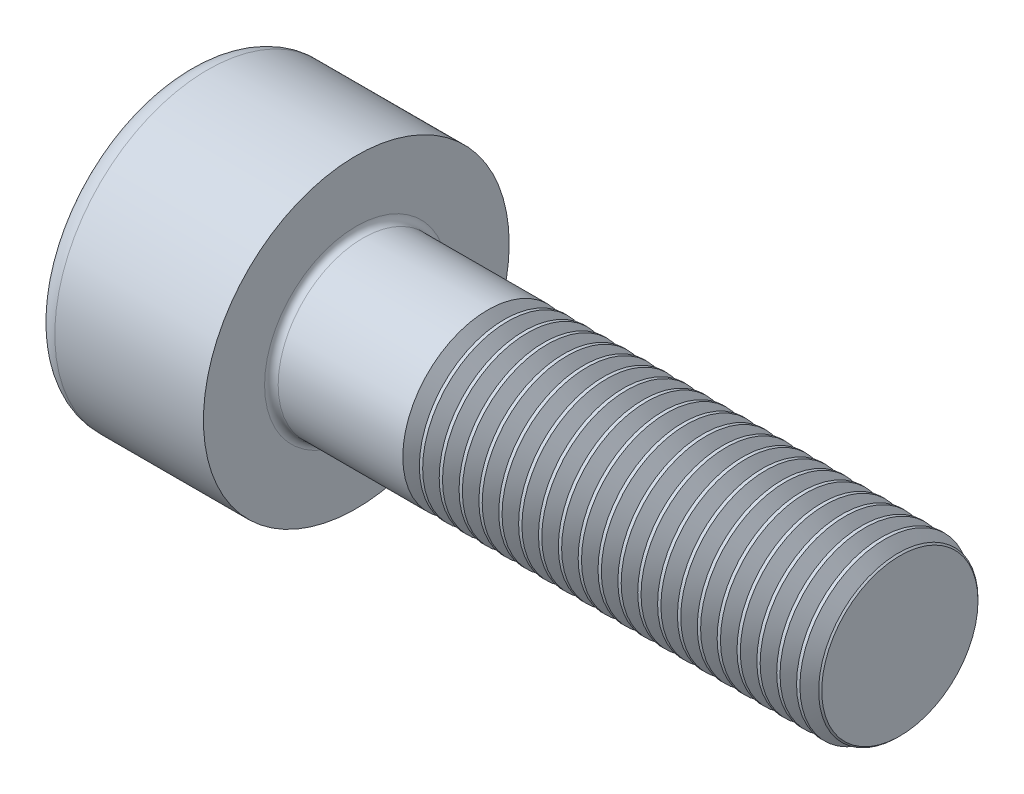
from build123d import *

# Parameters (mm, degrees)
SKETCH1_R           = 2.25
BASEHEAD_DEPTH      = 2.5
SKETCH2_R           = 1.25
BASEBODY_DEPTH      = 8
HEXAGONSOCKET_DEPTH = 1.1
HEADFILLET_R        = 0.1
TOPFILLET_R         = 0.3125
CHAMFER1_SIZE       = 0.1
LPATTERN10_COUNT    = 21
LPATTERN10_PITCH    = 0.2922


with BuildPart() as part:
    # Sketch1 → BaseHead (new body)
    with BuildSketch(Plane(origin=(0, 0, 0), x_dir=(0, 0, -1), z_dir=(1, 0, 0))):
        Circle(SKETCH1_R)
    extrude(amount=BASEHEAD_DEPTH)

    # Sketch2 → BaseBody (add)
    with BuildSketch(Plane(origin=(2.5, 0, 0), x_dir=(0, 0, -1), z_dir=(1, 0, 0))):
        Circle(SKETCH2_R)
    extrude(amount=BASEBODY_DEPTH)

    # Sketch3 → HexagonSocket (cut)
    with BuildSketch(Plane(origin=(0, 0, 0), x_dir=(0, 0, -1), z_dir=(1, 0, 0))):
        Polygon((1.154700538, 0), (0.577350269, 1), (-0.577350269, 1), (-1.154700538, 0), (-0.577350269, -1), (0.577350269, -1), align=None)
    extrude(amount=HEXAGONSOCKET_DEPTH, mode=Mode.SUBTRACT)

    # Sketch4 → Cut-Revolve1 (revolve, cut)
    with BuildSketch(Plane(origin=(-4.19613823, 0.75, 0), x_dir=(-1, 0, 0), z_dir=(0, 0, 1)), mode=Mode.PRIVATE) as cut_revolve1_sk:
        Polygon((-5.29613823, 1.75), (-5.873488499, 0.75), (-5.29613823, 0.75), align=None)
    revolve(cut_revolve1_sk.sketch.rotate(Axis((0.838992387, 0, 0), (-1, 0, 0)), 90), axis=Axis((0.838992387, 0, 0), (-1, 0, 0)), mode=Mode.SUBTRACT)

    # HeadFillet
    headfillet_edges = [part.edges().sort_by_distance(p)[0] for p in [
        (2.5, 0, 1.25),
    ]]
    fillet(headfillet_edges, radius=HEADFILLET_R)

    # TopFillet
    topfillet_edges = [part.edges().sort_by_distance(p)[0] for p in [
        (0, 0, 2.25),
    ]]
    fillet(topfillet_edges, radius=TOPFILLET_R)

    # Chamfer1
    chamfer1_edges = [part.edges().sort_by_distance(p)[0] for p in [
        (10.5, 0, 1.25),
    ]]
    chamfer(chamfer1_edges, length=CHAMFER1_SIZE)

    # Sketch5 → Cut-Revolve10 (revolve, cut)
    with BuildSketch(Plane.XY, mode=Mode.PRIVATE) as cut_revolve10_sk:
        Polygon((10.4, 1.039122814), (10.52175, 1.25), (10.52175, 1.4935), (10.27825, 1.4935), (10.27825, 1.25), align=None)
    cut_revolve10 = revolve(cut_revolve10_sk.sketch.rotate(Axis((0, 0, 0), (1, 0, 0)), 90), axis=Axis((0, 0, 0), (1, 0, 0)), mode=Mode.SUBTRACT)

    # LPattern10: Cut-Revolve10 ×21
    with Locations(*[(-i * LPATTERN10_PITCH, 0, 0) for i in range(1, LPATTERN10_COUNT)]):
        add(cut_revolve10, mode=Mode.SUBTRACT)


solid = part.part
